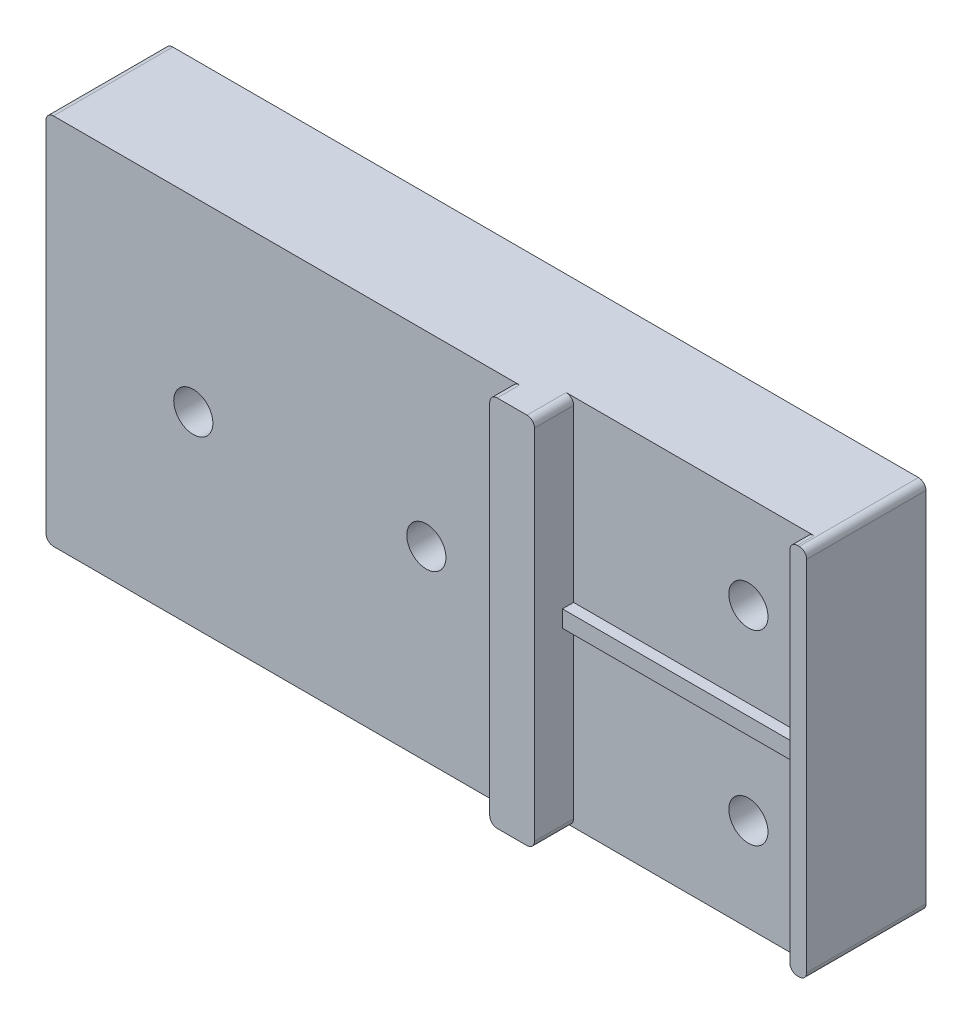
from build123d import *

# Parameters (mm, degrees)
BOSS_EXTRUDE1_DEPTH = 40
SKETCH6_R           = 2.1
CUT_EXTRUDE4_DEPTH  = 12.8
CUT_EXTRUDE7_REACH  = 60.186
SKETCH10_R          = 2.1
SKETCH11_R          = 4.75
CUT_EXTRUDE8_DEPTH  = 4.5
BOSS_EXTRUDE2_START = -0.6
SKETCH12_R          = 2.1
BOSS_EXTRUDE2_DEPTH = 0.6
SKETCH13_W          = 25
SKETCH13_H          = 1.8
BOSS_EXTRUDE3_DEPTH = 1.2
FILLET1_R           = 0.8


with BuildPart() as part:
    # Sketch1 → Boss-Extrude1 (new body)
    with BuildSketch(Plane.XZ):
        Polygon((14, 15.2), (14, 12.8), (14, 11), (39, 11), (39, 12.8), (40.8, 12.8), (40.8, 0), (-40.8, 0), (-40.8, 12.8), (9.2, 12.8), (9.2, 15.2), align=None)
    extrude(amount=BOSS_EXTRUDE1_DEPTH)

    # Sketch6 → Cut-Extrude4 (cut)
    with BuildSketch(Plane(origin=(0, 0, 0), x_dir=(-1, 0, 0), z_dir=(0, 0, -1))):
        with Locations((25, -20)):
            Circle(SKETCH6_R)
        with Locations((0, -20)):
            Circle(SKETCH6_R)
    extrude(amount=-CUT_EXTRUDE4_DEPTH, mode=Mode.SUBTRACT)

    # Sketch10 → Cut-Extrude7 (cut, up to next)
    with BuildSketch(Plane.XY.offset(11), mode=Mode.PRIVATE) as cut_extrude7_sk1:
        with Locations((32.75, -10)):
            Circle(SKETCH10_R)
    cut_extrude7_tool1 = extrude(cut_extrude7_sk1.sketch, amount=-CUT_EXTRUDE7_REACH, mode=Mode.PRIVATE) & part.part
    # Sketch10 → Cut-Extrude7 (cut, up to next)
    with BuildSketch(Plane.XY.offset(11), mode=Mode.PRIVATE) as cut_extrude7_sk2:
        with Locations((32.75, -30)):
            Circle(SKETCH10_R)
    cut_extrude7_tool2 = extrude(cut_extrude7_sk2.sketch, amount=-CUT_EXTRUDE7_REACH, mode=Mode.PRIVATE) & part.part
    add(cut_extrude7_tool1.solids().sort_by_distance((32.75, -10, 11))[0], mode=Mode.SUBTRACT)
    add(cut_extrude7_tool2.solids().sort_by_distance((32.75, -30, 11))[0], mode=Mode.SUBTRACT)

    # Sketch11 → Cut-Extrude8 (cut)
    with BuildSketch(Plane(origin=(0, 0, 0), x_dir=(-1, 0, 0), z_dir=(0, 0, -1))):
        with Locations((-32.75, -10)):
            Circle(SKETCH11_R)
        with Locations((-32.75, -30)):
            Circle(SKETCH11_R)
    extrude(amount=-CUT_EXTRUDE8_DEPTH, mode=Mode.SUBTRACT)

    # Sketch12 → Boss-Extrude2 (add)
    with BuildSketch(Plane(origin=(0, 0, 4.5), x_dir=(-1, 0, 0), z_dir=(0, 0, -1)).offset(BOSS_EXTRUDE2_START)):
        with Locations(Location((-32.75, -10, 0), (0, 0, 180))):
            Circle(SKETCH12_R)
        with Locations(Location((-32.75, -30, 0), (0, 0, 180))):
            Circle(SKETCH12_R)
    extrude(amount=BOSS_EXTRUDE2_DEPTH)

    # Sketch13 → Boss-Extrude3 (add)
    with BuildSketch(Plane.XY.offset(11)):
        with Locations((26.5, -20)):
            Rectangle(SKETCH13_W, SKETCH13_H)
    extrude(amount=BOSS_EXTRUDE3_DEPTH)

    # Fillet1
    fillet1_edges = [part.edges().sort_by_distance(p)[0] for p in [
        (39, 0, 11.9),
        (40.8, 0, 6.4),
        (-40.8, 0, 6.4),
        (9.2, 0, 14),
        (14, 0, 13.1),
        (9.2, -40, 14),
        (-40.8, -40, 6.4),
        (40.8, -40, 6.4),
        (39, -40, 11.9),
        (14, -40, 13.1),
    ]]
    fillet(fillet1_edges, radius=FILLET1_R)


solid = part.part
